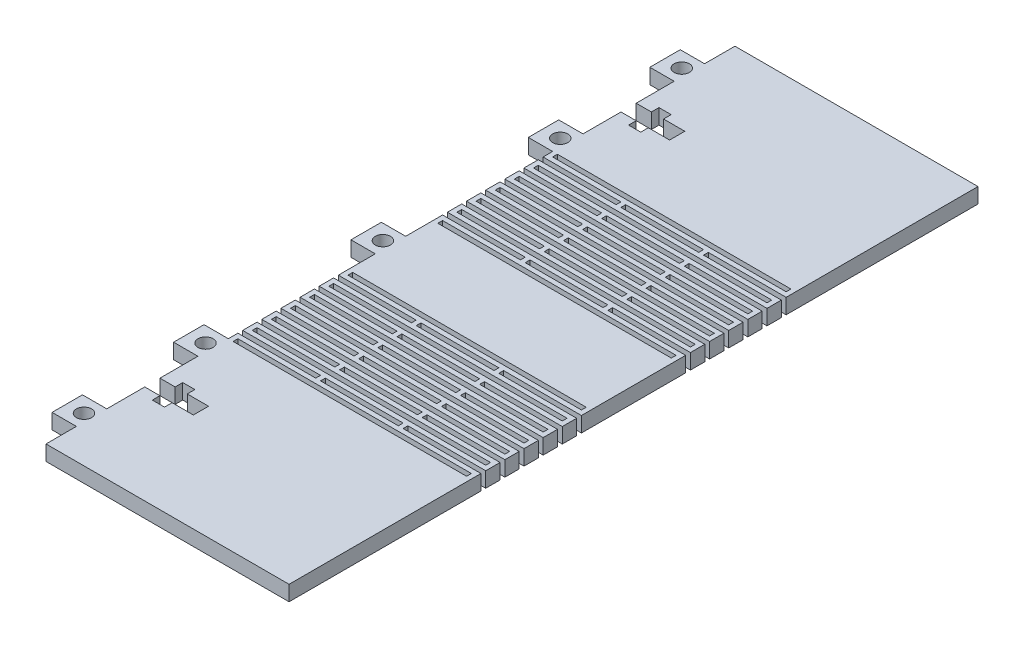
from build123d import *

# Parameters (mm, degrees)
SKETCH1_W                 = 50.8
SKETCH1_H                 = 38.1
BOSS_EXTRUDE1_DEPTH       = 3.175
SKETCH2_W                 = 5.08
SKETCH2_H                 = 6.35
BOSS_EXTRUDE2_DEPTH       = 3.175
SKETCH3_R                 = 1.5875
CUT_EXTRUDE1_DEPTH        = 37.083424519
LPATTERN1_COUNT           = 2
LPATTERN1_PITCH           = 25.4
CUT_EXTRUDE5_DEPTH        = 37.083424519
SKETCH4_W                 = 50.8
SKETCH4_H                 = 25
BOSS_EXTRUDE3_DEPTH       = 3.175
SKETCH5_W                 = 48.8
SKETCH5_H                 = 1
SKETCH5_W_2               = 16.266666667
SKETCH5_W_3               = 16.266666666
CUT_EXTRUDE2_DEPTH        = 54.661098805
LPATTERN2_COUNT           = 6
LPATTERN2_PITCH           = 4
SKETCH6_W                 = 48.8
SKETCH6_H                 = 1
CUT_EXTRUDE3_DEPTH        = 54.661098805
SKETCH7_W                 = 50.8
SKETCH7_H                 = 17.78
BOSS_EXTRUDE4_DEPTH       = 3.175
SKETCH8_W                 = 5.08
SKETCH8_H                 = 6.35
BOSS_EXTRUDE5_DEPTH       = 3.175
SKETCH9_R                 = 1.5875
CUT_EXTRUDE4_DEPTH        = 70.007680189
MIRROR1_COPY_1_SKETCH_W   = 48.8
MIRROR1_COPY_1_SKETCH_H   = 1
MIRROR1_COPY_1_SKETCH_W_2 = 16.266666667
MIRROR1_COPY_1_SKETCH_W_3 = 16.266666666
MIRROR1_COPY_1_DEPTH      = 54.661098805
MIRROR1_COPY_2_SKETCH_W   = 48.8
MIRROR1_COPY_2_SKETCH_H   = 1
MIRROR1_COPY_2_SKETCH_W_2 = 16.266666667
MIRROR1_COPY_2_SKETCH_W_3 = 16.266666666
MIRROR1_COPY_2_DEPTH      = 54.661098805
MIRROR1_COPY_3_SKETCH_W   = 48.8
MIRROR1_COPY_3_SKETCH_H   = 1
MIRROR1_COPY_3_SKETCH_W_2 = 16.266666667
MIRROR1_COPY_3_SKETCH_W_3 = 16.266666666
MIRROR1_COPY_3_DEPTH      = 54.661098805
MIRROR1_COPY_4_SKETCH_W   = 48.8
MIRROR1_COPY_4_SKETCH_H   = 1
MIRROR1_COPY_4_SKETCH_W_2 = 16.266666667
MIRROR1_COPY_4_SKETCH_W_3 = 16.266666666
MIRROR1_COPY_4_DEPTH      = 54.661098805
MIRROR1_COPY_5_SKETCH_W   = 48.8
MIRROR1_COPY_5_SKETCH_H   = 1
MIRROR1_COPY_5_SKETCH_W_2 = 16.266666667
MIRROR1_COPY_5_SKETCH_W_3 = 16.266666666
MIRROR1_COPY_5_DEPTH      = 54.661098805
SKETCH10_W                = 50.8
SKETCH10_H                = 38.1
BOSS_EXTRUDE6_DEPTH       = 3.175
MIRROR3_COPY_1_SKETCH_W   = 5.08
MIRROR3_COPY_1_SKETCH_H   = 6.35
MIRROR3_COPY_1_DEPTH      = 3.175
MIRROR3_COPY_2_SKETCH_R   = 1.5875
MIRROR3_COPY_2_DEPTH      = 37.083424519


with BuildPart() as part:
    # Sketch1 → Boss-Extrude1 (new body)
    with BuildSketch(Plane(origin=(0, 0, 0), x_dir=(1, 0, 0), z_dir=(0, 1, 0))):
        Rectangle(SKETCH1_W, SKETCH1_H)
    extrude(amount=BOSS_EXTRUDE1_DEPTH)

    # Sketch2 → Boss-Extrude2 (add)
    with BuildSketch(Plane(origin=(0, 3.175, 0), x_dir=(1, 0, 0), z_dir=(0, 1, 0))):
        with Locations((-27.94, 9.525)):
            Rectangle(SKETCH2_W, SKETCH2_H)
    boss_extrude2 = extrude(amount=-BOSS_EXTRUDE2_DEPTH)

    # Sketch3 → Cut-Extrude1 (cut, through all)
    with BuildSketch(Plane(origin=(0, 3.175, 0), x_dir=(1, 0, 0), z_dir=(0, 1, 0))):
        with Locations(Location((-26.9875, 9.525, 0), (0, 0, 270))):
            Circle(SKETCH3_R)
    cut_extrude1 = extrude(amount=-CUT_EXTRUDE1_DEPTH, mode=Mode.SUBTRACT)

    # LPattern1: Boss-Extrude2, Cut-Extrude1 ×2
    with Locations(*[(0, 0, i * LPATTERN1_PITCH) for i in range(1, LPATTERN1_COUNT)]):
        add(boss_extrude2)
        add(cut_extrude1, mode=Mode.SUBTRACT)

    # Sketch11 → Cut-Extrude5 (cut, through all)
    with BuildSketch(Plane(origin=(0, 3.175, 0), x_dir=(1, 0, 0), z_dir=(0, 1, 0))):
        Polygon((-22.225, -1.5875), (-22.225, 0), (-19.685, 0), (-19.685, -1.5875), (-15.24, -1.5875), (-15.24, -4.7625), (-19.685, -4.7625), (-19.685, -6.35), (-22.225, -6.35), (-22.225, -4.7625), (-25.4, -4.7625), (-25.4, -1.5875), align=None)
    cut_extrude5 = extrude(amount=-CUT_EXTRUDE5_DEPTH, mode=Mode.SUBTRACT)

    # Sketch4 → Boss-Extrude3 (add)
    with BuildSketch(Plane(origin=(0, 3.175, 0), x_dir=(1, 0, 0), z_dir=(0, 1, 0))):
        with Locations((0, -31.55)):
            Rectangle(SKETCH4_W, SKETCH4_H)
    boss_extrude3 = extrude(amount=-BOSS_EXTRUDE3_DEPTH)

    # Sketch5 → Cut-Extrude2 (cut, through all)
    with BuildSketch(Plane(origin=(0, 3.175, 0), x_dir=(1, 0, 0), z_dir=(0, 1, 0))):
        with Locations((0, -19.55)):
            Rectangle(SKETCH5_W, SKETCH5_H)
        with Locations((-17.266666667, -21.55)):
            Rectangle(SKETCH5_W_2, SKETCH5_H)
        with Locations((0, -21.55)):
            Rectangle(SKETCH5_W_3, SKETCH5_H)
        with Locations((17.266666667, -21.55)):
            Rectangle(SKETCH5_W_2, SKETCH5_H)
    cut_extrude2 = extrude(amount=-CUT_EXTRUDE2_DEPTH, mode=Mode.SUBTRACT)

    # LPattern2: Cut-Extrude2 ×6
    with Locations(*[(0, 0, i * LPATTERN2_PITCH) for i in range(1, LPATTERN2_COUNT)]):
        add(cut_extrude2, mode=Mode.SUBTRACT)

    # Sketch6 → Cut-Extrude3 (cut, through all)
    with BuildSketch(Plane(origin=(0, 3.175, 0), x_dir=(1, 0, 0), z_dir=(0, 1, 0))):
        with Locations((0, -43.55)):
            Rectangle(SKETCH6_W, SKETCH6_H)
    cut_extrude3 = extrude(amount=-CUT_EXTRUDE3_DEPTH, mode=Mode.SUBTRACT)

    # Sketch7 → Boss-Extrude4 (add)
    with BuildSketch(Plane(origin=(0, 3.175, 0), x_dir=(1, 0, 0), z_dir=(0, 1, 0))):
        with Locations((0, -52.94)):
            Rectangle(SKETCH7_W, SKETCH7_H)
    extrude(amount=-BOSS_EXTRUDE4_DEPTH)

    # Sketch8 → Boss-Extrude5 (add)
    with BuildSketch(Plane(origin=(0, 3.175, 0), x_dir=(1, 0, 0), z_dir=(0, 1, 0))):
        with Locations((-27.94, -52.94)):
            Rectangle(SKETCH8_W, SKETCH8_H)
    extrude(amount=-BOSS_EXTRUDE5_DEPTH)

    # Sketch9 → Cut-Extrude4 (cut, through all)
    with BuildSketch(Plane(origin=(0, 3.175, 0), x_dir=(1, 0, 0), z_dir=(0, 1, 0))):
        with Locations(Location((-26.9875, -52.94, 0), (0, 0, 270))):
            Circle(SKETCH9_R)
    extrude(amount=-CUT_EXTRUDE4_DEPTH, mode=Mode.SUBTRACT)

    # Mirror1: Boss-Extrude3, Cut-Extrude2, Cut-Extrude3 across plane
    add(boss_extrude3.mirror(Plane(origin=(0, 0, 52.94), x_dir=(1, 0, 0), z_dir=(0, 0, -1))))
    add(cut_extrude2.mirror(Plane(origin=(0, 0, 52.94), x_dir=(1, 0, 0), z_dir=(0, 0, -1))), mode=Mode.SUBTRACT)
    add(cut_extrude3.mirror(Plane(origin=(0, 0, 52.94), x_dir=(1, 0, 0), z_dir=(0, 0, -1))), mode=Mode.SUBTRACT)

    # Mirror1 copy 1 sketch → Mirror1 copy 1 (cut, through all)
    with BuildSketch(Plane(origin=(0, 3.175, 101.88), x_dir=(1, 0, 0), z_dir=(0, 1, 0))):
        with Locations((0, 19.55)):
            Rectangle(MIRROR1_COPY_1_SKETCH_W, MIRROR1_COPY_1_SKETCH_H)
        with Locations((-17.266666667, 21.55)):
            Rectangle(MIRROR1_COPY_1_SKETCH_W_2, MIRROR1_COPY_1_SKETCH_H)
        with Locations((0, 21.55)):
            Rectangle(MIRROR1_COPY_1_SKETCH_W_3, MIRROR1_COPY_1_SKETCH_H)
        with Locations((17.266666667, 21.55)):
            Rectangle(MIRROR1_COPY_1_SKETCH_W_2, MIRROR1_COPY_1_SKETCH_H)
    extrude(amount=-MIRROR1_COPY_1_DEPTH, mode=Mode.SUBTRACT)

    # Mirror1 copy 2 sketch → Mirror1 copy 2 (cut, through all)
    with BuildSketch(Plane(origin=(0, 3.175, 97.88), x_dir=(1, 0, 0), z_dir=(0, 1, 0))):
        with Locations((0, 19.55)):
            Rectangle(MIRROR1_COPY_2_SKETCH_W, MIRROR1_COPY_2_SKETCH_H)
        with Locations((-17.266666667, 21.55)):
            Rectangle(MIRROR1_COPY_2_SKETCH_W_2, MIRROR1_COPY_2_SKETCH_H)
        with Locations((0, 21.55)):
            Rectangle(MIRROR1_COPY_2_SKETCH_W_3, MIRROR1_COPY_2_SKETCH_H)
        with Locations((17.266666667, 21.55)):
            Rectangle(MIRROR1_COPY_2_SKETCH_W_2, MIRROR1_COPY_2_SKETCH_H)
    extrude(amount=-MIRROR1_COPY_2_DEPTH, mode=Mode.SUBTRACT)

    # Mirror1 copy 3 sketch → Mirror1 copy 3 (cut, through all)
    with BuildSketch(Plane(origin=(0, 3.175, 93.88), x_dir=(1, 0, 0), z_dir=(0, 1, 0))):
        with Locations((0, 19.55)):
            Rectangle(MIRROR1_COPY_3_SKETCH_W, MIRROR1_COPY_3_SKETCH_H)
        with Locations((-17.266666667, 21.55)):
            Rectangle(MIRROR1_COPY_3_SKETCH_W_2, MIRROR1_COPY_3_SKETCH_H)
        with Locations((0, 21.55)):
            Rectangle(MIRROR1_COPY_3_SKETCH_W_3, MIRROR1_COPY_3_SKETCH_H)
        with Locations((17.266666667, 21.55)):
            Rectangle(MIRROR1_COPY_3_SKETCH_W_2, MIRROR1_COPY_3_SKETCH_H)
    extrude(amount=-MIRROR1_COPY_3_DEPTH, mode=Mode.SUBTRACT)

    # Mirror1 copy 4 sketch → Mirror1 copy 4 (cut, through all)
    with BuildSketch(Plane(origin=(0, 3.175, 89.88), x_dir=(1, 0, 0), z_dir=(0, 1, 0))):
        with Locations((0, 19.55)):
            Rectangle(MIRROR1_COPY_4_SKETCH_W, MIRROR1_COPY_4_SKETCH_H)
        with Locations((-17.266666667, 21.55)):
            Rectangle(MIRROR1_COPY_4_SKETCH_W_2, MIRROR1_COPY_4_SKETCH_H)
        with Locations((0, 21.55)):
            Rectangle(MIRROR1_COPY_4_SKETCH_W_3, MIRROR1_COPY_4_SKETCH_H)
        with Locations((17.266666667, 21.55)):
            Rectangle(MIRROR1_COPY_4_SKETCH_W_2, MIRROR1_COPY_4_SKETCH_H)
    extrude(amount=-MIRROR1_COPY_4_DEPTH, mode=Mode.SUBTRACT)

    # Mirror1 copy 5 sketch → Mirror1 copy 5 (cut, through all)
    with BuildSketch(Plane(origin=(0, 3.175, 85.88), x_dir=(1, 0, 0), z_dir=(0, 1, 0))):
        with Locations((0, 19.55)):
            Rectangle(MIRROR1_COPY_5_SKETCH_W, MIRROR1_COPY_5_SKETCH_H)
        with Locations((-17.266666667, 21.55)):
            Rectangle(MIRROR1_COPY_5_SKETCH_W_2, MIRROR1_COPY_5_SKETCH_H)
        with Locations((0, 21.55)):
            Rectangle(MIRROR1_COPY_5_SKETCH_W_3, MIRROR1_COPY_5_SKETCH_H)
        with Locations((17.266666667, 21.55)):
            Rectangle(MIRROR1_COPY_5_SKETCH_W_2, MIRROR1_COPY_5_SKETCH_H)
    extrude(amount=-MIRROR1_COPY_5_DEPTH, mode=Mode.SUBTRACT)

    # Sketch10 → Boss-Extrude6 (add)
    with BuildSketch(Plane(origin=(0, 3.175, 0), x_dir=(1, 0, 0), z_dir=(0, 1, 0))):
        with Locations((0, -105.88)):
            Rectangle(SKETCH10_W, SKETCH10_H)
    extrude(amount=-BOSS_EXTRUDE6_DEPTH)

    # Mirror3: Boss-Extrude2, Cut-Extrude1, Cut-Extrude5 across plane
    add(boss_extrude2.mirror(Plane(origin=(0, 0, 52.94), x_dir=(1, 0, 0), z_dir=(0, 0, -1))))
    add(cut_extrude1.mirror(Plane(origin=(0, 0, 52.94), x_dir=(1, 0, 0), z_dir=(0, 0, -1))), mode=Mode.SUBTRACT)
    add(cut_extrude5.mirror(Plane(origin=(0, 0, 52.94), x_dir=(1, 0, 0), z_dir=(0, 0, -1))), mode=Mode.SUBTRACT)

    # Mirror3 copy 1 sketch → Mirror3 copy 1 (add)
    with BuildSketch(Plane(origin=(0, 3.175, 80.48), x_dir=(1, 0, 0), z_dir=(0, 1, 0))):
        with Locations((-27.94, -9.525)):
            Rectangle(MIRROR3_COPY_1_SKETCH_W, MIRROR3_COPY_1_SKETCH_H)
    extrude(amount=-MIRROR3_COPY_1_DEPTH)

    # Mirror3 copy 2 sketch → Mirror3 copy 2 (cut, through all)
    with BuildSketch(Plane(origin=(0, 3.175, 80.48), x_dir=(1, 0, 0), z_dir=(0, 1, 0))):
        with Locations((-26.9875, -9.525)):
            Circle(MIRROR3_COPY_2_SKETCH_R)
    extrude(amount=-MIRROR3_COPY_2_DEPTH, mode=Mode.SUBTRACT)


solid = part.part
